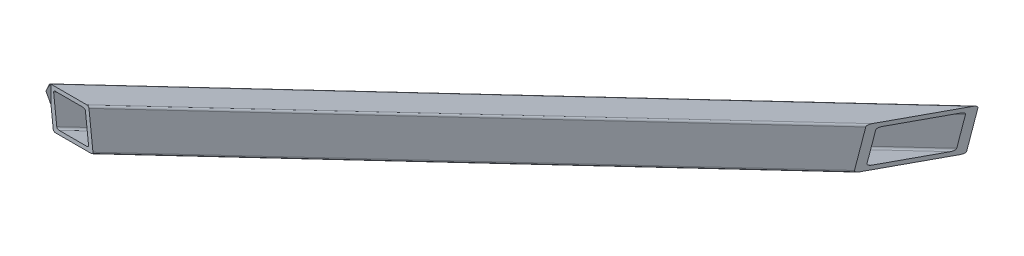
from build123d import *

# Parameters (mm, degrees)
BOSS_EXTRU_1_DEPTH            = 729
ENL_V_MAT_EXTRU_1_DEPTH       = 727
ESQUISSE3_W                   = 40
ESQUISSE3_H                   = 40
BOSS_EXTRU_2_DEPTH            = 814.58026
ENL_V_MAT_EXTRU_2_DEPTH       = 829.69546376
ENL_V_MAT_EXTRU_2_DEPTH_BACK  = 829.69546376
ESQUISSE4_W                   = 98.578400591
ESQUISSE4_H                   = 147.950096535
ESQUISSE4_W_2                 = 77.840885054
ESQUISSE4_H_2                 = 46.084081252
ESQUISSE7_W                   = 821.544509843
ESQUISSE7_H                   = 616.158382383
ESQUISSE7_W_2                 = 40
ESQUISSE7_H_2                 = 40
ENL_V_MAT_EXTRU_6_DEPTH       = 828.213294061
ESQUISSE8_W                   = 32
ESQUISSE8_H                   = 32
ENL_V_MAT_EXTRU_9_DEPTH       = 828.213294061
CONG_2_R                      = 2
ENL_V_MAT_EXTRU_10_DEPTH      = 815.022307134
ENL_V_MAT_EXTRU_10_DEPTH_BACK = 815.022307134
ESQUISSE9_W                   = 398.467294392
ESQUISSE9_H                   = 786.430421472


with BuildPart() as part:
    # Esquisse1 → Boss.-Extru.1 (new body)
    with BuildSketch(Plane.XY):
        Polygon((0, 0), (258, 0), (0, 256), align=None)
    extrude(amount=BOSS_EXTRU_1_DEPTH)

    # Esquisse2 → Enlèv. mat.-Extru.1 (cut)
    with BuildSketch(Plane.ZY):
        Polygon((0, 256), (729, 0), (729, 256), align=None)
    extrude(amount=-ENL_V_MAT_EXTRU_1_DEPTH, mode=Mode.SUBTRACT)

    # Esquisse3 → Boss.-Extru.2 (add)
    with BuildSketch(Plane(origin=(0, 256, 0), x_dir=(0.948516525956314, 0.10519863837129277, -0.2987467932423567), z_dir=(0.31672753768478995, -0.31427228545467534, 0.8949394378767902))):
        with Locations((20, -20)):
            Rectangle(ESQUISSE3_W, ESQUISSE3_H)
    extrude(amount=BOSS_EXTRU_2_DEPTH)

    # Esquisse4 → Enlèv. mat.-Extru.2 (cut, two sides: drawn at the far end of the back side and taken through both)
    with BuildSketch(Plane(origin=(0, 0, 0), x_dir=(-1, 0, 0), z_dir=(0, -1, 0)).offset(-ENL_V_MAT_EXTRU_2_DEPTH_BACK)):
        with Locations((-307.289200295, -655.024951733)):
            Rectangle(ESQUISSE4_W, ESQUISSE4_H)
        with Locations((-38.920442527, 23.042040626)):
            Rectangle(ESQUISSE4_W_2, ESQUISSE4_H_2)
    extrude(amount=ENL_V_MAT_EXTRU_2_DEPTH + ENL_V_MAT_EXTRU_2_DEPTH_BACK, mode=Mode.SUBTRACT)

    # Esquisse7 → Enlèv. mat.-Extru.6 (cut, through all)
    with BuildSketch(Plane(origin=(0, 256, 0), x_dir=(0.948516525956314, 0.10519863837129277, -0.2987467932423567), z_dir=(0.31672753768478995, -0.31427228545467534, 0.8949394378767902))):
        with Locations((22.907114777, -53.97111912)):
            Rectangle(ESQUISSE7_W, ESQUISSE7_H)
        with Locations((20, -20)):
            Rectangle(ESQUISSE7_W_2, ESQUISSE7_H_2, mode=Mode.SUBTRACT)
    extrude(amount=ENL_V_MAT_EXTRU_6_DEPTH, mode=Mode.SUBTRACT)

    # Esquisse8 → Enlèv. mat.-Extru.9 (cut, through all)
    with BuildSketch(Plane(origin=(0, 256, 0), x_dir=(0.948516525956314, 0.10519863837129277, -0.2987467932423567), z_dir=(0.31672753768478995, -0.31427228545467534, 0.8949394378767902))):
        with Locations((20, -20)):
            Rectangle(ESQUISSE8_W, ESQUISSE8_H)
    extrude(amount=ENL_V_MAT_EXTRU_9_DEPTH, mode=Mode.SUBTRACT)

    # Congé2
    cong_2_edges = [part.edges().sort_by_distance(p)[0] for p in [
        (131.343588352, 126.087109834, 357.878000354),
        (133.224361668, 94.037568496, 352.563722265),
        (150.092295167, 110.783988508, 304.90200319),
        (148.211521852, 142.833529846, 310.21628128),
        (129, 128, 364.5),
        (150.084916875, 148.933025015, 304.922851157),
        (152.435883519, 108.871098342, 298.280003544),
        (131.350966645, 87.938073327, 357.857152388),
    ]]
    fillet(cong_2_edges, radius=CONG_2_R)

    # Symétrie4: part across plane


with BuildPart() as part_1:
    add(part.part)
    add(part.part.mirror(Plane.XY))

    # Esquisse9 → Enlèv. mat.-Extru.10 (cut, two sides: drawn at the far end of the back side and taken through both)
    with BuildSketch(Plane(origin=(0, 0, 0), x_dir=(1, 0, 0), z_dir=(0, 1, 0)).offset(-ENL_V_MAT_EXTRU_10_DEPTH_BACK)):
        with Locations((201.342138883, -393.215210736)):
            Rectangle(ESQUISSE9_W, ESQUISSE9_H)
    extrude(amount=ENL_V_MAT_EXTRU_10_DEPTH + ENL_V_MAT_EXTRU_10_DEPTH_BACK, mode=Mode.SUBTRACT)


solid = part_1.part
